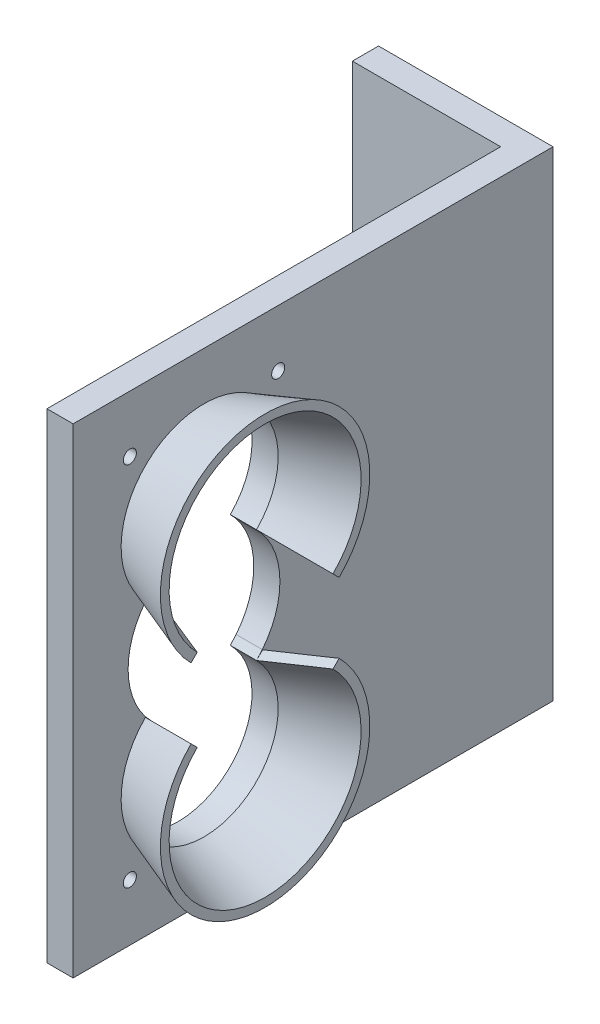
from build123d import *

# Parameters (mm, degrees)
EXTRUDE_1_DEPTH     = 27.5
SKETCH_2_R          = 1.5
CUT_EXTRUDE_1_DEPTH = 3
SKETCH_3_R          = 0.75
CUT_EXTRUDE_3_DEPTH = 3
REVOLVE_1_ANGLE     = 270


with BuildPart() as part:
    # 草图1 → 凸台-拉伸1 (new, symmetric)
    with BuildSketch(Plane(origin=(0, 0, 0), x_dir=(1, 0, 0), z_dir=(0, 1, 0))):
        Polygon((5.882352941, 27.284313725), (25.882352941, 27.284313725), (25.882352941, -27.715686275), (22.882352941, -27.715686275), (22.882352941, 24.284313725), (5.882352941, 24.284313725), align=None)
    extrude(amount=EXTRUDE_1_DEPTH, both=True)

    # 草图2 → 切除-拉伸1 (cut)
    with BuildSketch(Plane(origin=(0, 0, -27.284313725), x_dir=(-1, 0, 0), z_dir=(0, 0, -1))):
        with Locations((-13.382352941, 10)):
            Circle(SKETCH_2_R)
        with Locations((-13.382352941, -10)):
            Circle(SKETCH_2_R)
    extrude(amount=-CUT_EXTRUDE_1_DEPTH, mode=Mode.SUBTRACT)

    # 草图3 → 切除-拉伸3 (cut)
    with BuildSketch(Plane(origin=(25.882352941, 0, 0), x_dir=(0, 0, -1), z_dir=(1, 0, 0))):
        with BuildLine():
            ThreePointArc((-19.394463571, 5.743970558), (-21.414171084, 0), (-19.394463571, -5.743970558))
            Line((-19.394463571, -5.743970558), (-18.726093915, -6.48959236))
            ThreePointArc((-18.726093915, -6.48959236), (-12.715686275, -21), (-6.705278634, -6.48959236))
            Line((-6.705278634, -6.48959236), (-6.036908978, -5.743970558))
            ThreePointArc((-6.036908978, -5.743970558), (-4.017201465, 0), (-6.036908978, 5.743970558))
            Line((-6.036908978, 5.743970558), (-6.705278634, 6.48959236))
            ThreePointArc((-6.705278634, 6.48959236), (-12.715686275, 21), (-18.726093915, 6.48959236))
            Line((-18.726093915, 6.48959236), (-19.394463571, 5.743970558))
        make_face()
        with Locations((-4.215686275, -21)):
            Circle(SKETCH_3_R)
        with Locations((-21.215686275, -21)):
            Circle(SKETCH_3_R)
        with Locations((-4.215686275, 21)):
            Circle(SKETCH_3_R)
        with Locations((-21.215686275, 21)):
            Circle(SKETCH_3_R)
    extrude(amount=-CUT_EXTRUDE_3_DEPTH, mode=Mode.SUBTRACT)

    # 草图5 → 旋转1 (revolve, symmetric)
    with BuildSketch(Plane(origin=(0, 0, 12.715686275), x_dir=(0, -1, 0), z_dir=(0, 0, 1))) as revolve_1_sk:
        Polygon((-22, 25.882352941), (-24.5, 32.882352941), (-23.5, 32.882352941), (-21, 25.882352941), align=None)
    revolve_1 = revolve(axis=Axis((32.882352941, 12.5, 12.715686275), (-1, 0, 0)), revolution_arc=REVOLVE_1_ANGLE / 2)
    revolve_1 = revolve_1 + revolve(revolve_1_sk.sketch, axis=Axis((32.882352941, 12.5, 12.715686275), (1, 0, 0)), revolution_arc=REVOLVE_1_ANGLE / 2)

    # 镜向1: 旋转1 across plane
    add(revolve_1.mirror(Plane.ZX))


solid = part.part
